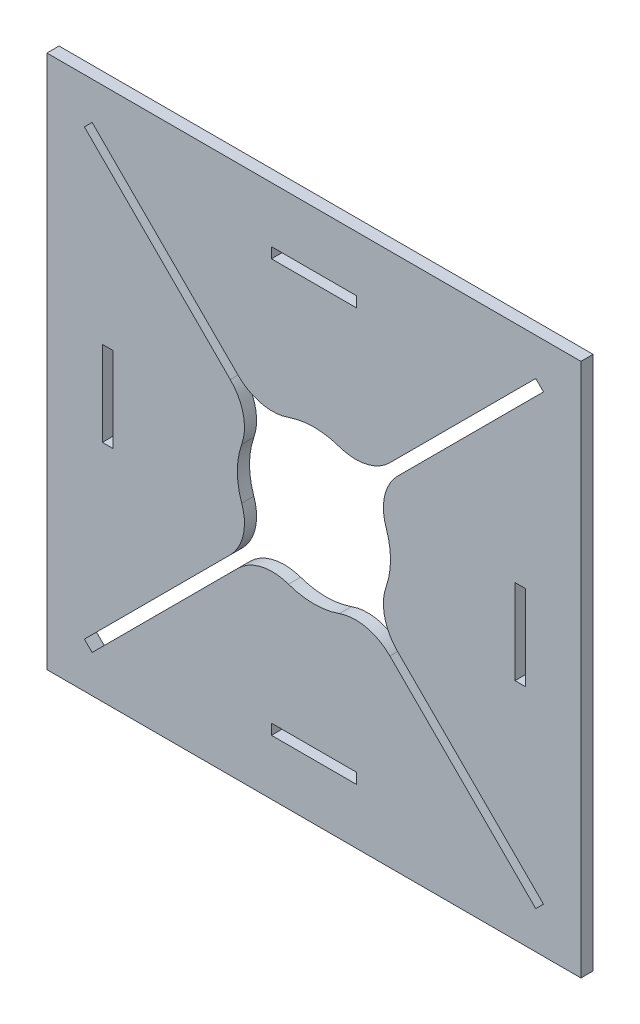
from build123d import *

# Parameters (mm, degrees)
SKETCH2_W           = 279.4
SKETCH2_H           = 279.4
SKETCH2_W_2         = 44.45
SKETCH2_H_2         = 5.5118
SKETCH2_W_3         = 5.5118
SKETCH2_H_3         = 44.45
BOSS_EXTRUDE1_DEPTH = 6.35


with BuildPart() as part:
    # Sketch2 → Boss-Extrude1 (new body)
    with BuildSketch(Plane.XY):
        Rectangle(SKETCH2_W, SKETCH2_H)
        with BuildLine():
            Line((-43.779617638, 39.738502384), (-120.083686649, 116.042571394))
            Line((-120.083686649, 116.042571394), (-116.042571394, 120.083686649))
            Line((-116.042571394, 120.083686649), (-39.738502384, 43.779617638))
            ThreePointArc((-39.738502384, 43.779617638), (-27.398923769, 36.969883512), (-13.328721415, 37.786636231))
            ThreePointArc((-13.328721415, 37.786636231), (0, 40.0685), (13.328721415, 37.786636231))
            ThreePointArc((13.328721415, 37.786636231), (27.398923769, 36.969883512), (39.738502384, 43.779617638))
            Line((39.738502384, 43.779617638), (116.042571394, 120.083686649))
            Line((116.042571394, 120.083686649), (120.083686649, 116.042571394))
            Line((120.083686649, 116.042571394), (43.779617638, 39.738502384))
            ThreePointArc((43.779617638, 39.738502384), (36.969883512, 27.398923769), (37.786636231, 13.328721415))
            ThreePointArc((37.786636231, 13.328721415), (40.0685, 0), (37.786636231, -13.328721415))
            ThreePointArc((37.786636231, -13.328721415), (36.969883512, -27.398923769), (43.779617638, -39.738502384))
            Line((43.779617638, -39.738502384), (120.083686649, -116.042571394))
            Line((120.083686649, -116.042571394), (116.042571394, -120.083686649))
            Line((116.042571394, -120.083686649), (39.738502384, -43.779617638))
            ThreePointArc((39.738502384, -43.779617638), (27.398923769, -36.969883512), (13.328721415, -37.786636231))
            ThreePointArc((13.328721415, -37.786636231), (0, -40.0685), (-13.328721415, -37.786636231))
            ThreePointArc((-13.328721415, -37.786636231), (-27.398923769, -36.969883512), (-39.738502384, -43.779617638))
            Line((-39.738502384, -43.779617638), (-116.042571394, -120.083686649))
            Line((-116.042571394, -120.083686649), (-120.083686649, -116.042571394))
            Line((-120.083686649, -116.042571394), (-43.779617638, -39.738502384))
            ThreePointArc((-43.779617638, -39.738502384), (-36.969883512, -27.398923769), (-37.786636231, -13.328721415))
            ThreePointArc((-37.786636231, -13.328721415), (-40.0685, 0), (-37.786636231, 13.328721415))
            ThreePointArc((-37.786636231, 13.328721415), (-36.969883512, 27.398923769), (-43.779617638, 39.738502384))
        make_face(mode=Mode.SUBTRACT)
        with Locations((0, -107.95)):
            Rectangle(SKETCH2_W_2, SKETCH2_H_2, mode=Mode.SUBTRACT)
        with Locations((-107.95, 0)):
            Rectangle(SKETCH2_W_3, SKETCH2_H_3, mode=Mode.SUBTRACT)
        with Locations((0, 107.95)):
            Rectangle(SKETCH2_W_2, SKETCH2_H_2, mode=Mode.SUBTRACT)
        with Locations((107.95, 0)):
            Rectangle(SKETCH2_W_3, SKETCH2_H_3, mode=Mode.SUBTRACT)
    extrude(amount=BOSS_EXTRUDE1_DEPTH)


solid = part.part
